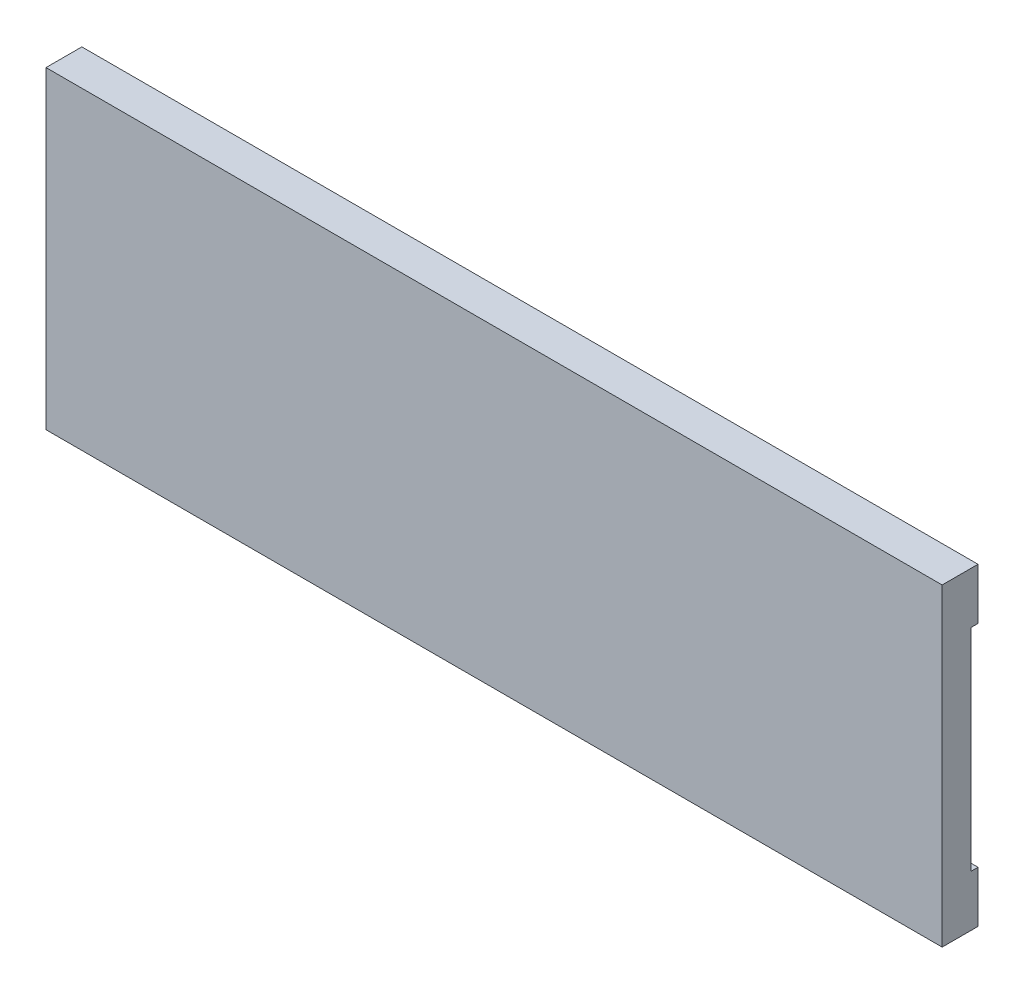
from build123d import *

# Parameters (mm, degrees)
SKETCH1_W           = 127
SKETCH1_H           = 44.45
BOSS_EXTRUDE1_DEPTH = 5.08
CUT_EXTRUDE1_DEPTH  = 0.9652


with BuildPart() as part:
    # Sketch1 → Boss-Extrude1 (new body)
    with BuildSketch(Plane.XY):
        Rectangle(SKETCH1_W, SKETCH1_H)
    extrude(amount=BOSS_EXTRUDE1_DEPTH)

    # Sketch3 → Cut-Extrude1 (cut)
    with BuildSketch(Plane(origin=(0, 0, 0), x_dir=(-1, 0, 0), z_dir=(0, 0, -1))):
        with BuildLine():
            Line((-63.5, 14.9606), (-34.365536726, 14.9606))
            ThreePointArc((-34.365536726, 14.9606), (-31.071645561, 14.039483955), (-28.733362586, 11.543365668))
            ThreePointArc((-28.733362586, 11.543365668), (-25.908, 0), (-28.733362586, -11.543365668))
            ThreePointArc((-28.733362586, -11.543365668), (-31.071645561, -14.039483955), (-34.365536726, -14.9606))
            Line((-34.365536726, -14.9606), (-63.5, -14.9606))
            Line((-63.5, -14.9606), (-63.5, 14.9606))
        make_face()
    extrude(amount=-CUT_EXTRUDE1_DEPTH, mode=Mode.SUBTRACT)


solid = part.part
